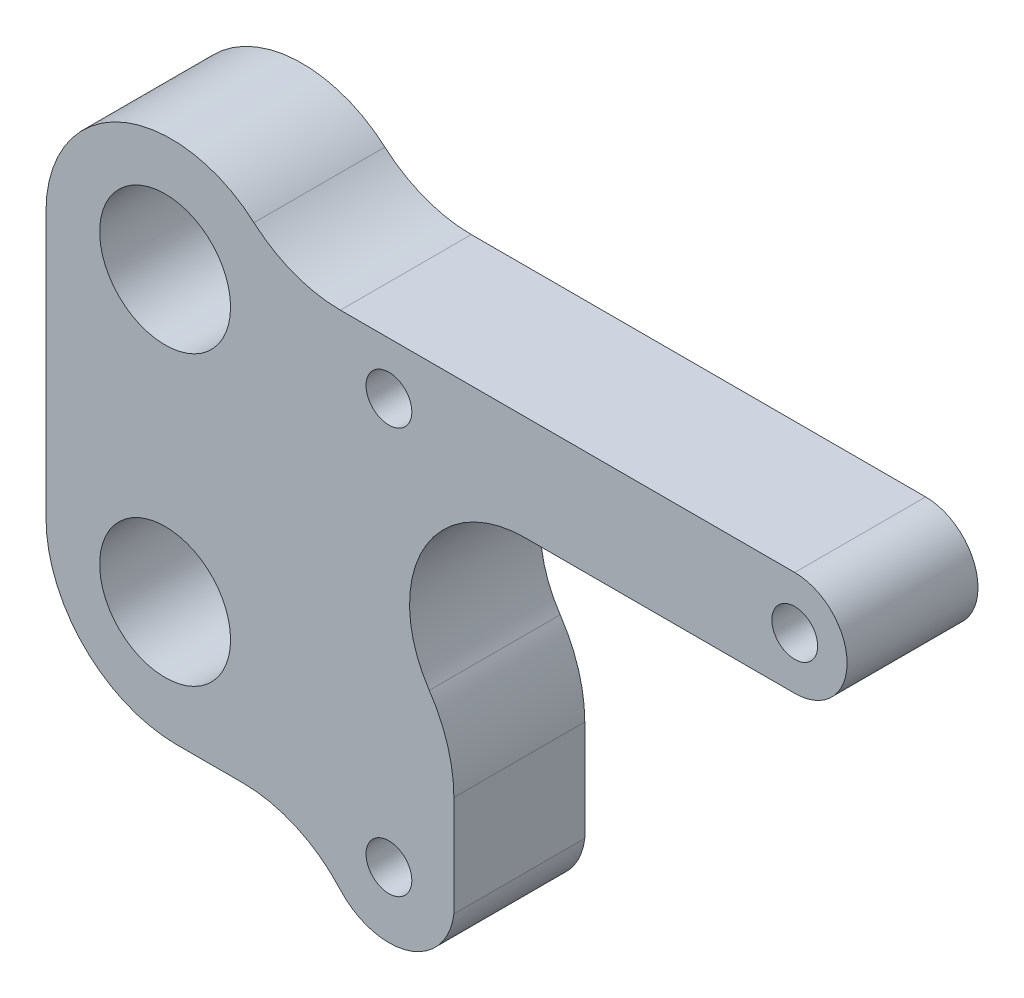
from build123d import *

# Parameters (mm, degrees)
SKETCH1_R           = 1.75
SKETCH1_R_2         = 5
BOSS_EXTRUDE1_DEPTH = 10


with BuildPart() as part:
    # Sketch1 → Boss-Extrude1 (new body)
    with BuildSketch(Plane.XY):
        with BuildLine():
            Line((59.115327383, 43.551262968), (93.822811009, 43.551262968))
            ThreePointArc((93.822811009, 43.551262968), (97.822811009, 39.551262968), (93.822811009, 35.551262968))
            Line((93.822811009, 35.551262968), (73.221068218, 35.551262968))
            ThreePointArc((73.221068218, 35.551262968), (65.430500205, 30.870379763), (65.905746743, 21.794160382))
            ThreePointArc((65.905746743, 21.794160382), (67.305407589, 18.859363547), (67.785956814, 15.64359686))
            Line((67.785956814, 15.64359686), (67.785956814, 7.945306105))
            ThreePointArc((67.785956814, 7.945306105), (67.117243875, 5.990433735), (65.715264602, 4.47281814))
            ThreePointArc((65.715264602, 4.47281814), (62.263505272, 3.582643734), (59.096031047, 5.217929635))
            ThreePointArc((59.096031047, 5.217929635), (55.724954026, 7.67997226), (51.642471122, 8.551262968))
            Line((51.642471122, 8.551262968), (46.626949913, 8.551262968))
            ThreePointArc((46.626949913, 8.551262968), (39.555882101, 11.480195156), (36.626949913, 18.551262968))
            Line((36.626949913, 18.551262968), (36.626949913, 38.848632096))
            ThreePointArc((36.626949913, 38.848632096), (42.251881835, 47.568318218), (52.515088487, 46.03881686))
            ThreePointArc((52.515088487, 46.03881686), (55.588605185, 44.19379373), (59.115327383, 43.551262968))
        make_face()
        with Locations((93.822811009, 39.551262968)):
            Circle(SKETCH1_R, mode=Mode.SUBTRACT)
        with Locations((62.822811009, 39.551262968)):
            Circle(SKETCH1_R, mode=Mode.SUBTRACT)
        with Locations((62.822811009, 8.551262968)):
            Circle(SKETCH1_R, mode=Mode.SUBTRACT)
        with Locations((45.725055781, 39.551262968)):
            Circle(SKETCH1_R_2, mode=Mode.SUBTRACT)
        with Locations((45.725055781, 17.551264875)):
            Circle(SKETCH1_R_2, mode=Mode.SUBTRACT)
    extrude(amount=-BOSS_EXTRUDE1_DEPTH)


solid = part.part
